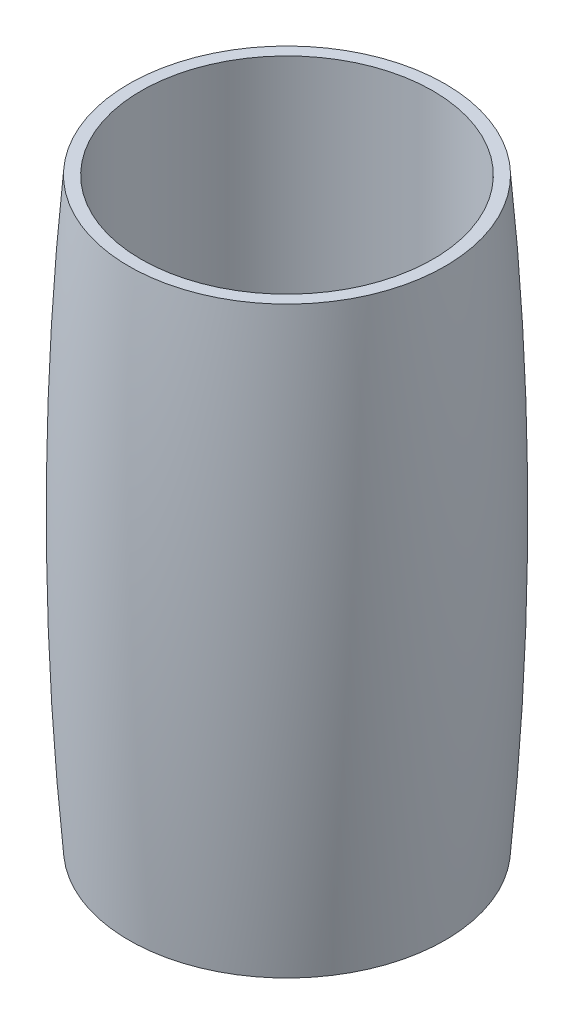
from build123d import *


with BuildPart() as part:
    # Sketch2 → Revolve1 (revolve)
    with BuildSketch(Plane.XY, mode=Mode.PRIVATE) as revolve1_sk:
        with BuildLine():
            Line((38.1, 152.4), (38.1, 0))
            Line((38.1, 0), (41.275, 0))
            ThreePointArc((41.275, 0), (44.45, 76.2), (41.275, 152.4))
            Line((41.275, 152.4), (38.1, 152.4))
        make_face()
    revolve(revolve1_sk.sketch.rotate(Axis((0, 0, 0), (0, 1, 0)), 90), axis=Axis((0, 0, 0), (0, 1, 0)))


solid = part.part
